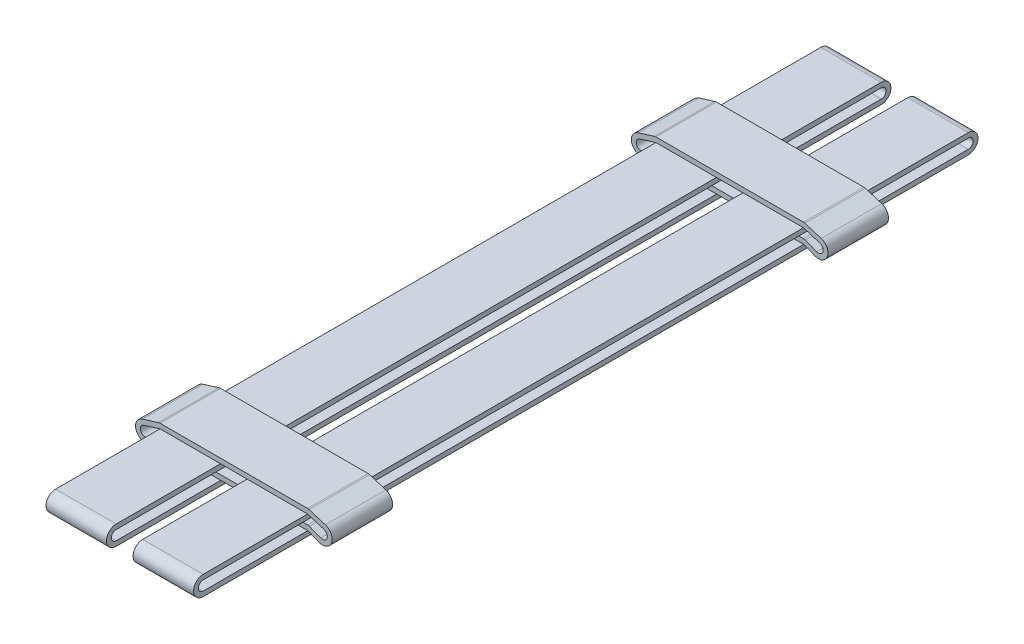
from build123d import *

# Parameters (mm, degrees)
EXTRUDE_THIN1_START = 5.5
EXTRUDE_THIN1_DEPTH = 25
EXTRUDE_THIN2_START = 90
EXTRUDE_THIN2_DEPTH = 25
FILLET1_R           = 2


with BuildPart() as part:
    # Sketch1 → Extrude-Thin1 (new body)
    with BuildSketch(Plane(origin=(0, 0, 0), x_dir=(0, 0, -1), z_dir=(1, 0, 0)).offset(EXTRUDE_THIN1_START)):
        with BuildLine():
            Line((158.15, -4), (-158.15, -4))
            ThreePointArc((-158.15, -4), (-162.15, 0), (-158.15, 4))
            Line((-158.15, 4), (158.15, 4))
            ThreePointArc((158.15, 4), (162.15, 0), (158.15, -4))
        make_face()
        with BuildLine():
            Line((158.15, -2), (-158.15, -2))
            ThreePointArc((-158.15, -2), (-160.15, 0), (-158.15, 2))
            Line((-158.15, 2), (158.15, 2))
            ThreePointArc((158.15, 2), (160.15, 0), (158.15, -2))
        make_face(mode=Mode.SUBTRACT)
    extrude(amount=EXTRUDE_THIN1_DEPTH)


with BuildPart() as body_2:
    # Mirror3: mirrored copy
    add(part.part.mirror(Plane(origin=(0, 0, 0), x_dir=(0, 0, 1), z_dir=(1, 0, 0))))


with BuildPart() as body_3:
    # Sketch3 → Extrude-Thin2 (new body)
    with BuildSketch(Plane.XY.offset(EXTRUDE_THIN2_START)):
        with BuildLine():
            Line((-37.834190406, 3.820692749), (-30.802835169, 6))
            Line((-30.802835169, 6), (30.802835169, 6))
            Line((30.802835169, 6), (37.834190406, 3.820692749))
            ThreePointArc((37.834190406, 3.820692749), (40.426672016, -1.317857536), (35.200106572, -3.727976535))
            Line((35.200106572, -3.727976535), (30.5, -1.9))
            Line((30.5, -1.9), (-30.5, -1.9))
            Line((-30.5, -1.9), (-35.200106572, -3.727976535))
            ThreePointArc((-35.200106572, -3.727976535), (-40.426672016, -1.317857536), (-37.834190406, 3.820692749))
        make_face()
        with BuildLine():
            Line((-37.242095203, 1.910346375), (-30.5, 4))
            Line((-30.5, 4), (30.5, 4))
            Line((30.5, 4), (37.242095203, 1.910346375))
            ThreePointArc((37.242095203, 1.910346375), (38.538336008, -0.658928768), (35.925053286, -1.863988268))
            Line((35.925053286, -1.863988268), (31.224946714, -0.036011732))
            ThreePointArc((31.224946714, -0.036011732), (30.868797685, 0.065702996), (30.5, 0.1))
            Line((30.5, 0.1), (-30.5, 0.1))
            ThreePointArc((-30.5, 0.1), (-30.868797685, 0.065702996), (-31.224946714, -0.036011732))
            Line((-31.224946714, -0.036011732), (-35.925053286, -1.863988268))
            ThreePointArc((-35.925053286, -1.863988268), (-38.538336008, -0.658928768), (-37.242095203, 1.910346375))
        make_face(mode=Mode.SUBTRACT)
    extrude(amount=EXTRUDE_THIN2_DEPTH)

    # Fillet1
    fillet1_edges = [body_3.edges().sort_by_distance(p)[0] for p in [
        (-30.802835169, 6, 102.5),
        (30.802835169, 6, 102.5),
    ]]
    fillet(fillet1_edges, radius=FILLET1_R)


with BuildPart() as body_4:
    # Mirror4: mirrored copy
    add(body_3.part.mirror(Plane.XY))


solid = Compound([part.part, body_2.part, body_3.part, body_4.part])
